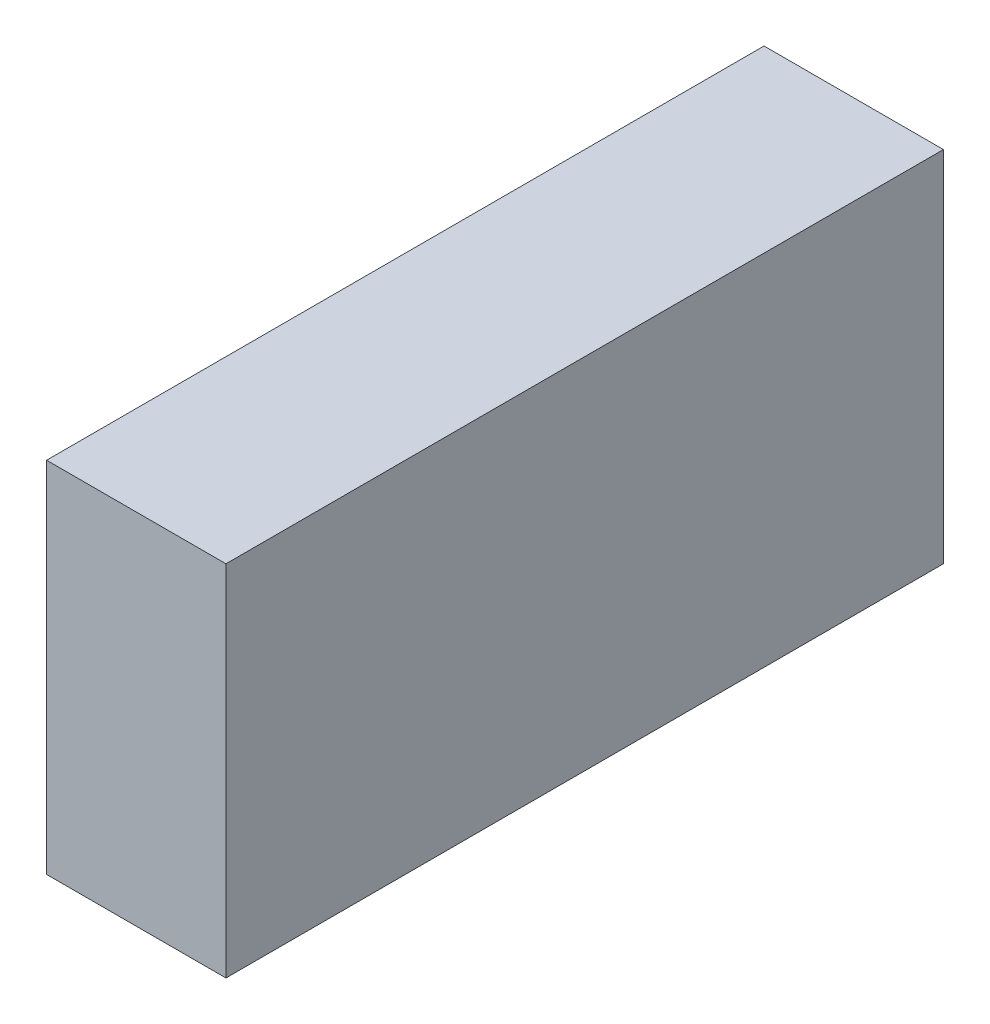
from build123d import *

# Parameters (mm, degrees)
SKETCH_1_W      = 20
SKETCH_1_H      = 40
EXTRUDE_2_DEPTH = 80


with BuildPart() as part:
    # 草圖1 → 填料-伸長2 (new body)
    with BuildSketch(Plane.XY):
        with Locations((7.2965409, -18.684573003)):
            Rectangle(SKETCH_1_W, SKETCH_1_H)
    extrude(amount=EXTRUDE_2_DEPTH)


solid = part.part
